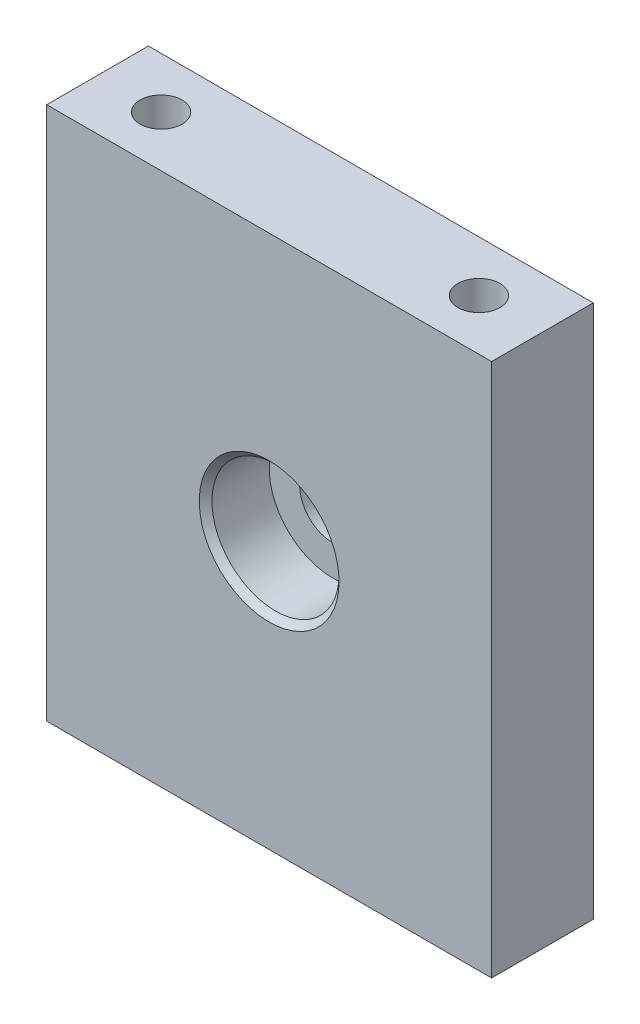
from build123d import *

# Parameters (mm, degrees)
SKETCH_1_W          = 35
SKETCH_1_H          = 42
EXTRUDE_1_DEPTH     = 4
SKETCH_4_R          = 10
EXTRUDE_2_DEPTH     = 3.5
CUT_EXTRUDE_START   = -2
CUT_EXTRUDE_2_DEPTH = 2
SKETCH_6_R          = 2.6
CUT_EXTRUDE_3_DEPTH = 30.656365253
SKETCH_7_R          = 5
CUT_EXTRUDE_4_DEPTH = 5
CHAMFER_1_SIZE      = 0.5
CHAMFER_2_SIZE      = 0.5
CHAMFER_3_SIZE      = 1
HOLE_WIZARD_M4_1_D  = 3.3


with BuildPart() as part:
    # 草图1 → 凸台-拉伸1 (new, symmetric)
    with BuildSketch(Plane.XY):
        Rectangle(SKETCH_1_W, SKETCH_1_H)
    extrude(amount=EXTRUDE_1_DEPTH, both=True)

    # 草图4 → 凸台-拉伸2 (add)
    with BuildSketch(Plane(origin=(0, 0, -4), x_dir=(-1, 0, 0), z_dir=(0, 0, -1))):
        with Locations(Location((0, 0, 0), (0, 0, 180))):
            Circle(SKETCH_4_R)
        with BuildLine():
            Line((-5, 6), (5, 6))
            ThreePointArc((5, 6), (5.707106781, 5.707106781), (6, 5))
            Line((6, 5), (6, -5))
            ThreePointArc((6, -5), (5.707106781, -5.707106781), (5, -6))
            Line((5, -6), (-5, -6))
            ThreePointArc((-5, -6), (-5.707106781, -5.707106781), (-6, -5))
            Line((-6, -5), (-6, 5))
            ThreePointArc((-6, 5), (-5.707106781, 5.707106781), (-5, 6))
        make_face(mode=Mode.SUBTRACT)
    extrude(amount=EXTRUDE_2_DEPTH)

    # 草图5 → 切除-拉伸2 (cut)
    with BuildSketch(Plane(origin=(0, 0, -4), x_dir=(-1, 0, 0), z_dir=(0, 0, -1)).offset(CUT_EXTRUDE_START)):
        with BuildLine():
            Line((6, -5), (6, 5))
            ThreePointArc((6, 5), (5.707106781, 5.707106781), (5, 6))
            Line((5, 6), (-5, 6))
            ThreePointArc((-5, 6), (-5.707106781, 5.707106781), (-6, 5))
            Line((-6, 5), (-6, -5))
            ThreePointArc((-6, -5), (-5.707106781, -5.707106781), (-5, -6))
            Line((-5, -6), (5, -6))
            ThreePointArc((5, -6), (5.707106781, -5.707106781), (6, -5))
        make_face()
    extrude(amount=CUT_EXTRUDE_2_DEPTH, mode=Mode.SUBTRACT)

    # 草图6 → 切除-拉伸3 (cut, through all)
    with BuildSketch(Plane.XY.offset(4)):
        Circle(SKETCH_6_R)
    extrude(amount=-CUT_EXTRUDE_3_DEPTH, mode=Mode.SUBTRACT)

    # 草图7 → 切除-拉伸4 (cut)
    with BuildSketch(Plane.XY.offset(4)):
        Circle(SKETCH_7_R)
    extrude(amount=-CUT_EXTRUDE_4_DEPTH, mode=Mode.SUBTRACT)

    # 倒角1
    chamfer_1_edges = [part.edges().sort_by_distance(p)[0] for p in [
        (-5.707106781, 5.707106781, -7.5),
        (0, 6, -7.5),
        (5.707106781, 5.707106781, -7.5),
        (6, 0, -7.5),
        (5.707106781, -5.707106781, -7.5),
        (0, -6, -7.5),
        (-5.707106781, -5.707106781, -7.5),
        (-6, 0, -7.5),
    ]]
    chamfer(chamfer_1_edges, length=CHAMFER_1_SIZE)

    # 倒角2
    chamfer_2_edges = [part.edges().sort_by_distance(p)[0] for p in [
        (-5, 0, 4),
    ]]
    chamfer(chamfer_2_edges, length=CHAMFER_2_SIZE)

    # 倒角3
    chamfer_3_edges = [part.edges().sort_by_distance(p)[0] for p in [
        (-10, 0, -4),
    ]]
    chamfer(chamfer_3_edges, length=CHAMFER_3_SIZE)

    # M4 螺纹孔1 (through all)
    with Locations(Plane(origin=(0, 21, 0), x_dir=(1, 0, 0), z_dir=(0, 1, 0))):
        with Locations((-12.5, 0), (12.5, 0)):
            Hole(HOLE_WIZARD_M4_1_D / 2)


solid = part.part
